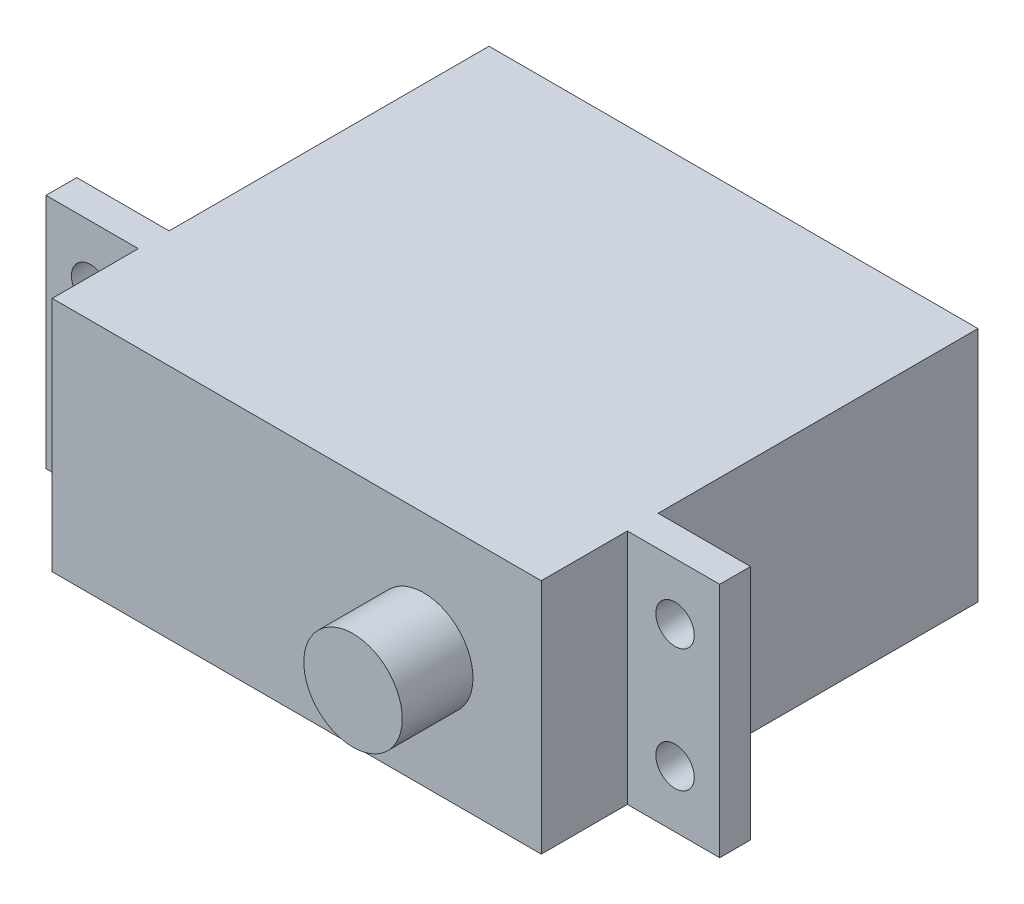
from build123d import *

# Parameters (mm, degrees)
SKETCH1_W           = 40.386
SKETCH1_H           = 19.558
BOSS_EXTRUDE1_DEPTH = 36.068
SKETCH2_W           = 7.627483077
SKETCH2_H           = 19.558
SKETCH2_R           = 1.5875
SKETCH2_W_2         = 7.627483076
BOSS_EXTRUDE2_DEPTH = 2.54
SKETCH3_R           = 4.064
BOSS_EXTRUDE3_DEPTH = 5.842


with BuildPart() as part:
    # Sketch1 → Boss-Extrude1 (new body)
    with BuildSketch(Plane.XY):
        with Locations((6770.286327778, 3542.568139787)):
            Rectangle(SKETCH1_W, SKETCH1_H)
    extrude(amount=BOSS_EXTRUDE1_DEPTH)

    # Sketch2 → Boss-Extrude2 (add)
    # profile 1 of 2: a face of its own
    with BuildSketch(Plane.XY.offset(28.956)):
        with Locations((6794.293069316, 3542.568139787)):
            Rectangle(SKETCH2_W, SKETCH2_H)
        with Locations((6794.416327778, 3537.488139787)):
            Circle(SKETCH2_R, mode=Mode.SUBTRACT)
        with Locations((6794.416327778, 3547.648139787)):
            Circle(SKETCH2_R, mode=Mode.SUBTRACT)
    # profile 2 of 2: a face of its own
    with BuildSketch(Plane.XY.offset(28.956)):
        with Locations((6746.27958624, 3542.568139787)):
            Rectangle(SKETCH2_W_2, SKETCH2_H)
        with Locations((6746.156327778, 3547.648139787)):
            Circle(SKETCH2_R, mode=Mode.SUBTRACT)
        with Locations((6746.156327778, 3537.488139787)):
            Circle(SKETCH2_R, mode=Mode.SUBTRACT)
    extrude(amount=-BOSS_EXTRUDE2_DEPTH)

    # Sketch3 → Boss-Extrude3 (add)
    with BuildSketch(Plane.XY.offset(36.068)):
        with Locations((6780.775840345, 3542.568139787)):
            Circle(SKETCH3_R)
    extrude(amount=BOSS_EXTRUDE3_DEPTH)


solid = part.part
